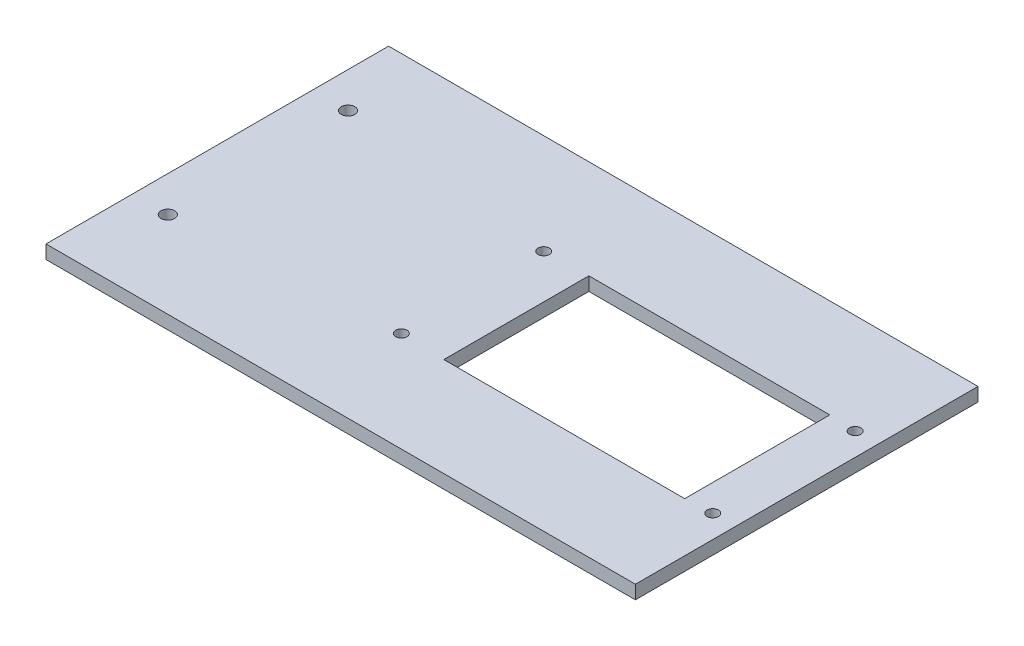
from build123d import *

# Parameters (mm, degrees)
SKETCH1_W           = 130.41
SKETCH1_H           = 75.8
BOSS_EXTRUDE1_DEPTH = 3
SKETCH1_4_W         = 53.3
SKETCH1_4_H         = 32.1
CUT_EXTRUDE2_DEPTH  = 151.868844033
SKETCH1_5_R         = 1.25
CUT_EXTRUDE3_DEPTH  = 151.868844033
SKETCH2_R           = 1.5
CUT_EXTRUDE4_DEPTH  = 151.868844033
SKETCH3_R           = 1.5
CUT_EXTRUDE5_DEPTH  = 151.868844033


with BuildPart() as part:
    # Sketch1 → Boss-Extrude1 (new body)
    with BuildSketch(Plane(origin=(0, 0, 0), x_dir=(1, 0, 0), z_dir=(0, 1, 0))):
        with Locations((65.205, -37.9)):
            Rectangle(SKETCH1_W, SKETCH1_H)
    extrude(amount=BOSS_EXTRUDE1_DEPTH)

    # Sketch1<4> → Cut-Extrude2 (cut, through all)
    with BuildSketch(Plane(origin=(0, 0, 0), x_dir=(1, 0, 0), z_dir=(0, 1, 0))):
        with Locations((92.82, -37.9)):
            Rectangle(SKETCH1_4_W, SKETCH1_4_H)
    extrude(amount=CUT_EXTRUDE2_DEPTH, mode=Mode.SUBTRACT)

    # Sketch1<5> → Cut-Extrude3 (cut, through all)
    with BuildSketch(Plane(origin=(0, 0, 0), x_dir=(1, 0, 0), z_dir=(0, 1, 0))):
        with Locations((56.47, -22.15)):
            Circle(SKETCH1_5_R)
        with Locations((125.37, -22.15)):
            Circle(SKETCH1_5_R)
        with Locations((125.37, -53.65)):
            Circle(SKETCH1_5_R)
        with Locations((56.47, -53.65)):
            Circle(SKETCH1_5_R)
    extrude(amount=CUT_EXTRUDE3_DEPTH, mode=Mode.SUBTRACT)

    # Sketch2 → Cut-Extrude4 (cut, through all)
    with BuildSketch(Plane(origin=(0, 3, 0), x_dir=(1, 0, 0), z_dir=(0, 1, 0))):
        with Locations((7.86, -16.83)):
            Circle(SKETCH2_R)
    extrude(amount=-CUT_EXTRUDE4_DEPTH, mode=Mode.SUBTRACT)

    # Sketch3 → Cut-Extrude5 (cut, through all)
    with BuildSketch(Plane(origin=(0, 3, 0), x_dir=(1, 0, 0), z_dir=(0, 1, 0))):
        with Locations((7.86, -56.71)):
            Circle(SKETCH3_R)
    extrude(amount=-CUT_EXTRUDE5_DEPTH, mode=Mode.SUBTRACT)


solid = part.part
